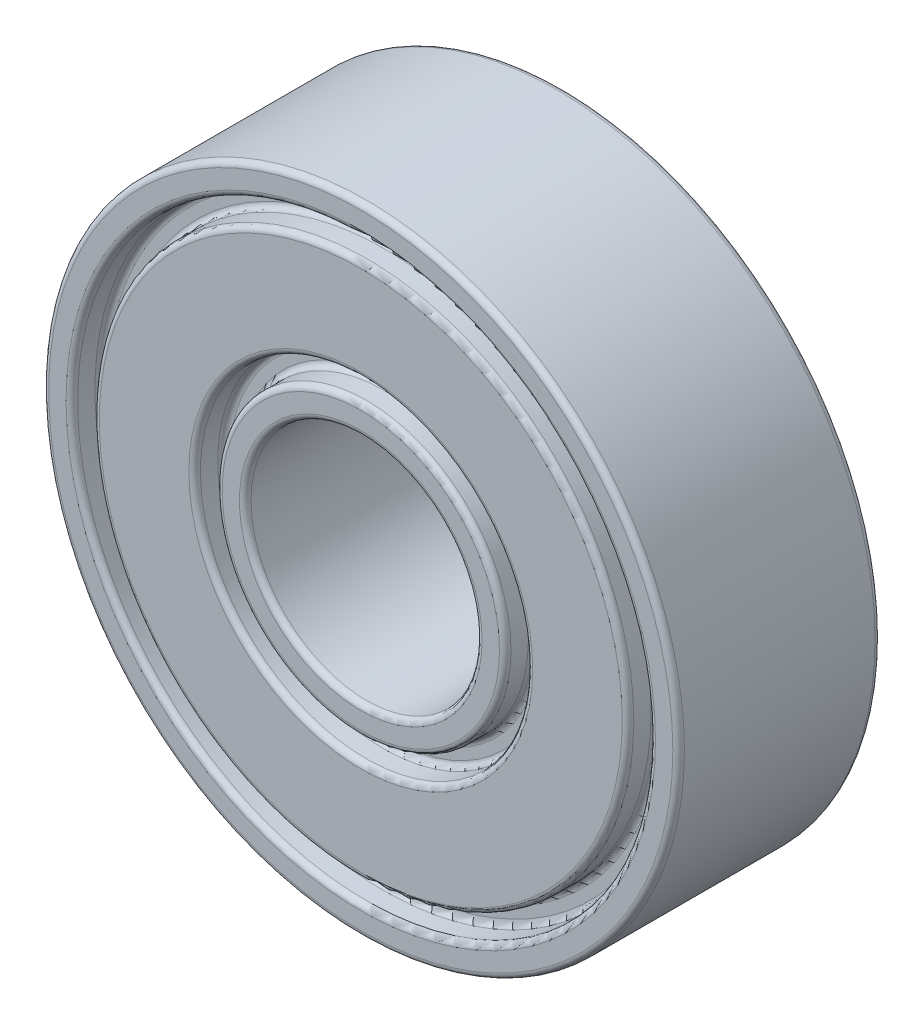
from build123d import *

# Parameters (mm, degrees)
SKETCH1_R           = 11
BOSS_EXTRUDE1_DEPTH = 7
SKETCH2_R           = 4
CUT_EXTRUDE1_DEPTH  = 7
SKETCH3_R           = 10
SKETCH3_R_2         = 9.25
SKETCH3_R_3         = 5.75
SKETCH3_R_4         = 5
CUT_EXTRUDE2_DEPTH  = 1
CUT_EXTRUDE3_START  = 6
SKETCH4_R           = 10
SKETCH4_R_2         = 9.25
SKETCH4_R_3         = 5.75
SKETCH4_R_4         = 5
CUT_EXTRUDE3_DEPTH  = 1
FILLET1_R           = 0.2


with BuildPart() as part:
    # Sketch1 → Boss-Extrude1 (new body)
    with BuildSketch(Plane.XY):
        Circle(SKETCH1_R)
    extrude(amount=BOSS_EXTRUDE1_DEPTH)

    # Sketch2 → Cut-Extrude1 (cut)
    with BuildSketch(Plane.XY):
        Circle(SKETCH2_R)
    extrude(amount=CUT_EXTRUDE1_DEPTH, mode=Mode.SUBTRACT)

    # Sketch3 → Cut-Extrude2 (cut)
    # profile 1 of 2: a face of its own
    with BuildSketch(Plane.XY):
        Circle(SKETCH3_R)
        Circle(SKETCH3_R_2, mode=Mode.SUBTRACT)
    # profile 2 of 2: a face of its own
    with BuildSketch(Plane.XY):
        Circle(SKETCH3_R_3)
        Circle(SKETCH3_R_4, mode=Mode.SUBTRACT)
    extrude(amount=CUT_EXTRUDE2_DEPTH, mode=Mode.SUBTRACT)

    # Sketch4 → Cut-Extrude3 (cut)
    # profile 1 of 2: a face of its own
    with BuildSketch(Plane.XY.offset(CUT_EXTRUDE3_START)):
        Circle(SKETCH4_R)
        Circle(SKETCH4_R_2, mode=Mode.SUBTRACT)
    # profile 2 of 2: a face of its own
    with BuildSketch(Plane.XY.offset(CUT_EXTRUDE3_START)):
        Circle(SKETCH4_R_3)
        Circle(SKETCH4_R_4, mode=Mode.SUBTRACT)
    extrude(amount=CUT_EXTRUDE3_DEPTH, mode=Mode.SUBTRACT)

    # Fillet1
    fillet1_edges = [part.edges().sort_by_distance(p)[0] for p in [
        (-9.25, 0, 1),
        (-10, 0, 0),
        (-10, 0, 1),
        (-9.25, 0, 0),
        (-11, 0, 0),
        (-5, 0, 1),
        (-5.75, 0, 0),
        (-5.75, 0, 1),
        (-5, 0, 0),
        (-5.75, 0, 6),
        (-5, 0, 6),
        (-5.75, 0, 7),
        (-5, 0, 7),
        (-10, 0, 6),
        (-9.25, 0, 6),
        (-10, 0, 7),
        (-9.25, 0, 7),
        (-11, 0, 7),
        (-4, 0, 0),
        (-4, 0, 7),
    ]]
    fillet(fillet1_edges, radius=FILLET1_R)


solid = part.part
